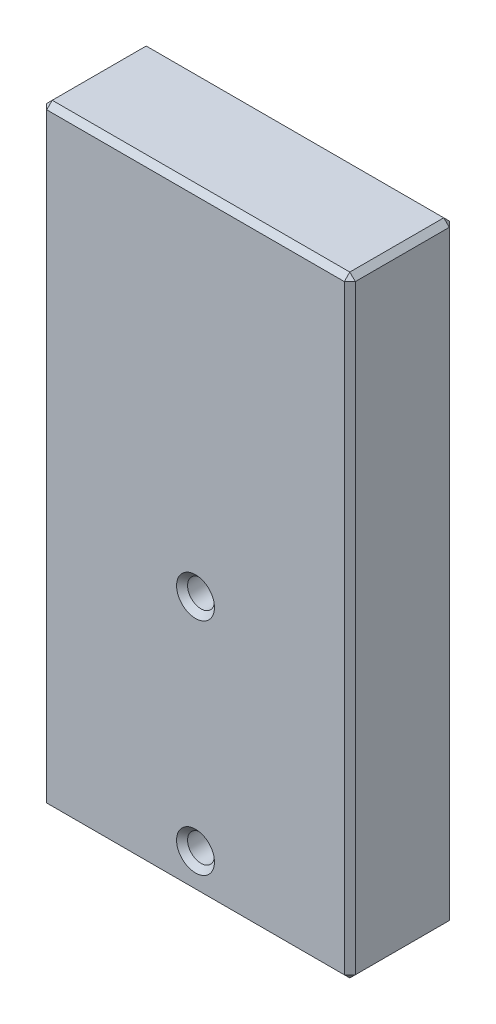
from build123d import *

# Parameters (mm, degrees)
SKETCH1_W           = 28
SKETCH1_H           = 55.475
BOSS_EXTRUDE1_DEPTH = 9.525
SKETCH2_R           = 1.2195
CUT_EXTRUDE1_DEPTH  = 20
SKETCH3_R           = 1.2195
CUT_EXTRUDE2_DEPTH  = 63.866535215
CHAMFER1_SIZE       = 0.5
CHAMFER2_SIZE       = 0.5


with BuildPart() as part:
    # Sketch1 → Boss-Extrude1 (new body)
    with BuildSketch(Plane.XY):
        with Locations((14, 27.7375)):
            Rectangle(SKETCH1_W, SKETCH1_H)
    extrude(amount=BOSS_EXTRUDE1_DEPTH)

    # Sketch2 → Cut-Extrude1 (cut)
    with BuildSketch(Plane.XZ):
        with Locations(Location((5, 4.7625, 0), (0, 0, 270))):
            Circle(SKETCH2_R)
        with Locations(Location((23, 4.7625, 0), (0, 0, 270))):
            Circle(SKETCH2_R)
    extrude(amount=-CUT_EXTRUDE1_DEPTH, mode=Mode.SUBTRACT)

    # Sketch3 → Cut-Extrude2 (cut, through all)
    with BuildSketch(Plane.XY.offset(9.525)):
        with Locations((14, 23.475)):
            Circle(SKETCH3_R)
        with Locations((14, 3.475)):
            Circle(SKETCH3_R)
    extrude(amount=-CUT_EXTRUDE2_DEPTH, mode=Mode.SUBTRACT)

    # Chamfer1
    chamfer1_edges = [part.edges().sort_by_distance(p)[0] for p in [
        (28, 27.7375, 9.525),
        (14, 55.475, 9.525),
        (0, 27.7375, 9.525),
        (14, 55.475, 0),
        (28, 27.7375, 0),
        (14, 0, 0),
        (0, 27.7375, 0),
        (14, 0, 9.525),
        (0, 55.475, 4.7625),
        (28, 55.475, 4.7625),
        (28, 0, 4.7625),
        (0, 0, 4.7625),
    ]]
    chamfer(chamfer1_edges, length=CHAMFER1_SIZE)

    # Chamfer2
    chamfer2_edges = [part.edges().sort_by_distance(p)[0] for p in [
        (5, 0, 5.982),
        (23, 0, 5.982),
        (12.7805, 23.475, 0),
        (12.7805, 23.475, 9.525),
        (12.7805, 3.475, 0),
        (12.7805, 3.475, 9.525),
    ]]
    chamfer(chamfer2_edges, length=CHAMFER2_SIZE)


solid = part.part
